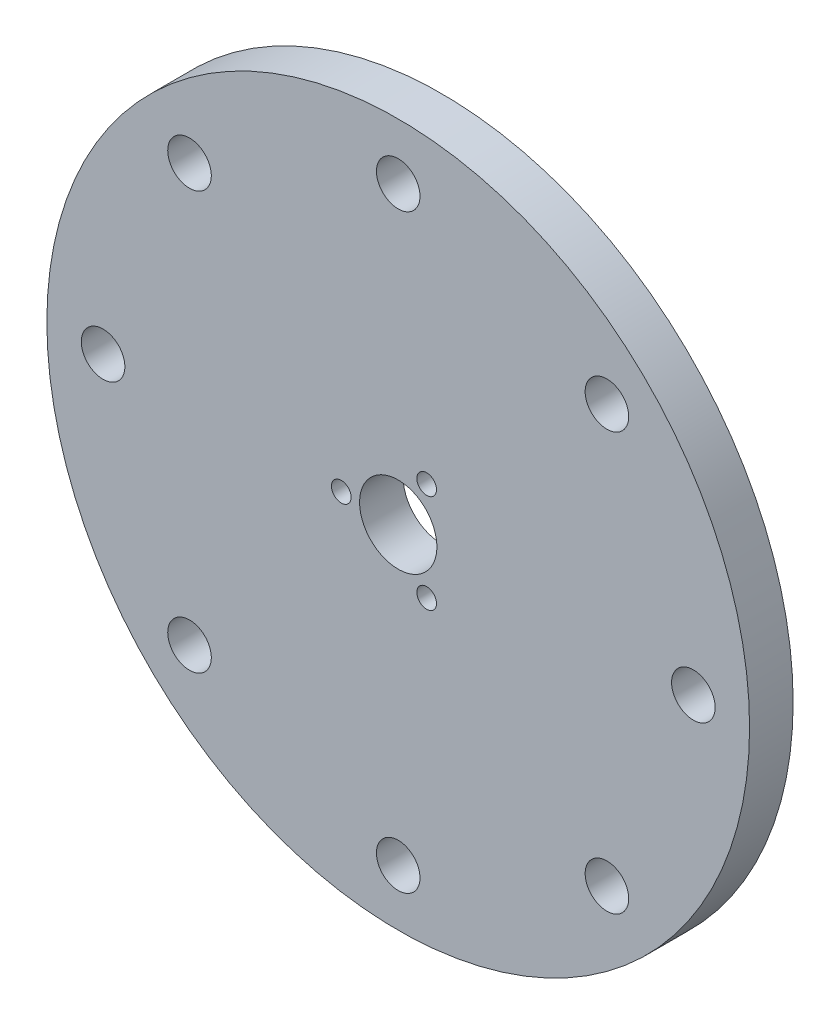
from build123d import *

# Parameters (mm, degrees)
SKETCH1_R           = 50
BOSS_EXTRUDE1_DEPTH = 6.2
SKETCH2_R           = 5.5
CUT_EXTRUDE1_DEPTH  = 71.981969542
SKETCH3_R           = 1.4
CUT_EXTRUDE2_DEPTH  = 71.981969542
SKETCH4_R           = 3.1
CUT_EXTRUDE3_DEPTH  = 71.981969542


with BuildPart() as part:
    # Sketch1 → Boss-Extrude1 (new body)
    with BuildSketch(Plane.XY):
        with Locations(Location((0, 0, 0), (0, 0, 180))):
            Circle(SKETCH1_R)
    extrude(amount=BOSS_EXTRUDE1_DEPTH)

    # Sketch2 → Cut-Extrude1 (cut, through all)
    with BuildSketch(Plane(origin=(0, 0, 0), x_dir=(-1, 0, 0), z_dir=(0, 0, -1))):
        Circle(SKETCH2_R)
    extrude(amount=-CUT_EXTRUDE1_DEPTH, mode=Mode.SUBTRACT)

    # Sketch3 → Cut-Extrude2 (cut, through all)
    with BuildSketch(Plane(origin=(0, 0, 0), x_dir=(-1, 0, 0), z_dir=(0, 0, -1))):
        with Locations((8.1, 0)):
            Circle(SKETCH3_R)
        with Locations((-4.05, -7.014805771)):
            Circle(SKETCH3_R)
        with Locations((-4.05, 7.014805771)):
            Circle(SKETCH3_R)
    extrude(amount=-CUT_EXTRUDE2_DEPTH, mode=Mode.SUBTRACT)

    # Sketch4 → Cut-Extrude3 (cut, through all)
    with BuildSketch(Plane(origin=(0, 0, 0), x_dir=(-1, 0, 0), z_dir=(0, 0, -1))):
        with Locations((42, 0)):
            Circle(SKETCH4_R)
        with Locations((29.69848481, -29.69848481)):
            Circle(SKETCH4_R)
        with Locations((0, -42)):
            Circle(SKETCH4_R)
        with Locations((-29.69848481, -29.69848481)):
            Circle(SKETCH4_R)
        with Locations((-42, 0)):
            Circle(SKETCH4_R)
        with Locations((-29.69848481, 29.69848481)):
            Circle(SKETCH4_R)
        with Locations((0, 42)):
            Circle(SKETCH4_R)
        with Locations((29.69848481, 29.69848481)):
            Circle(SKETCH4_R)
    extrude(amount=-CUT_EXTRUDE3_DEPTH, mode=Mode.SUBTRACT)


solid = part.part
